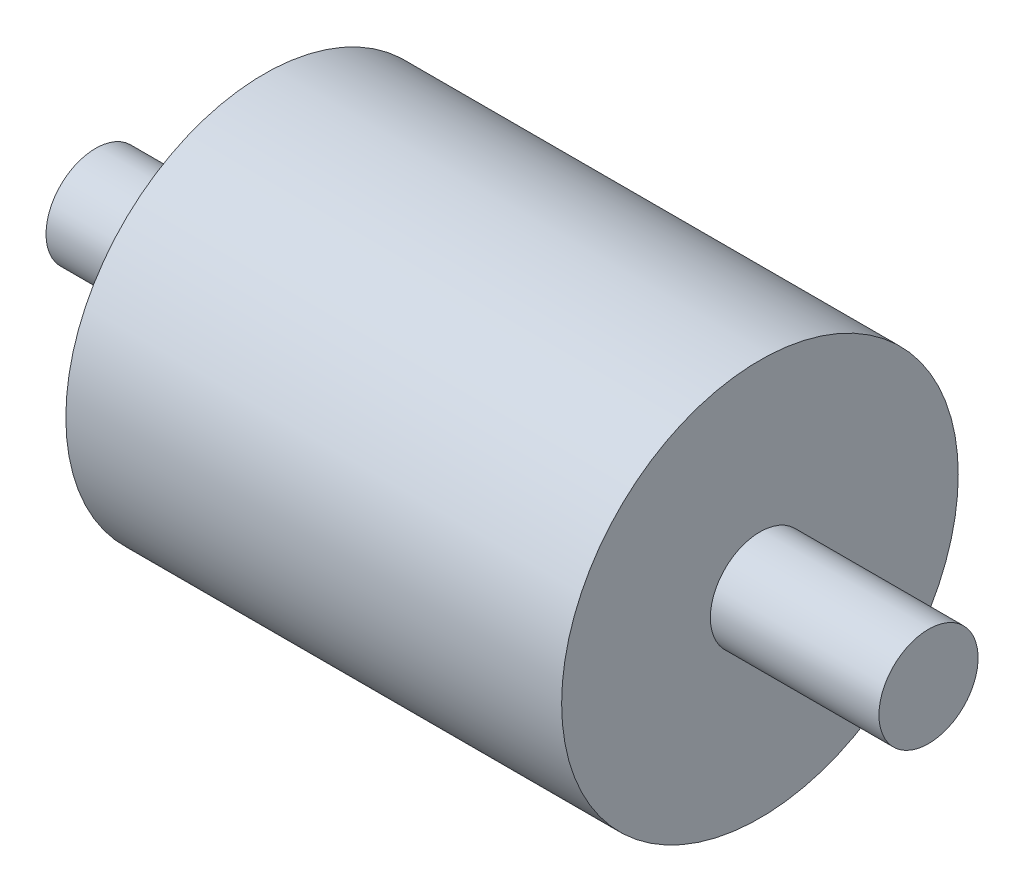
from build123d import *

# Parameters (mm, degrees)
SKETCH_1_R      = 20
EXTRUDE_1_DEPTH = 25
SKETCH_2_R      = 5
EXTRUDE_2_DEPTH = 42


with BuildPart() as part:
    # 草图1 → 凸台-拉伸1 (new, symmetric)
    with BuildSketch(Plane(origin=(0, 0, 0), x_dir=(0, 0, -1), z_dir=(1, 0, 0))):
        Circle(SKETCH_1_R)
    extrude(amount=EXTRUDE_1_DEPTH, both=True)

    # 草图2 → 凸台-拉伸2 (add, symmetric)
    with BuildSketch(Plane(origin=(0, 0, 0), x_dir=(0, 0, -1), z_dir=(1, 0, 0))):
        with Locations(Location((0, 0, 0), (0, 0, 180))):
            Circle(SKETCH_2_R)
    extrude(amount=EXTRUDE_2_DEPTH, both=True)


solid = part.part
